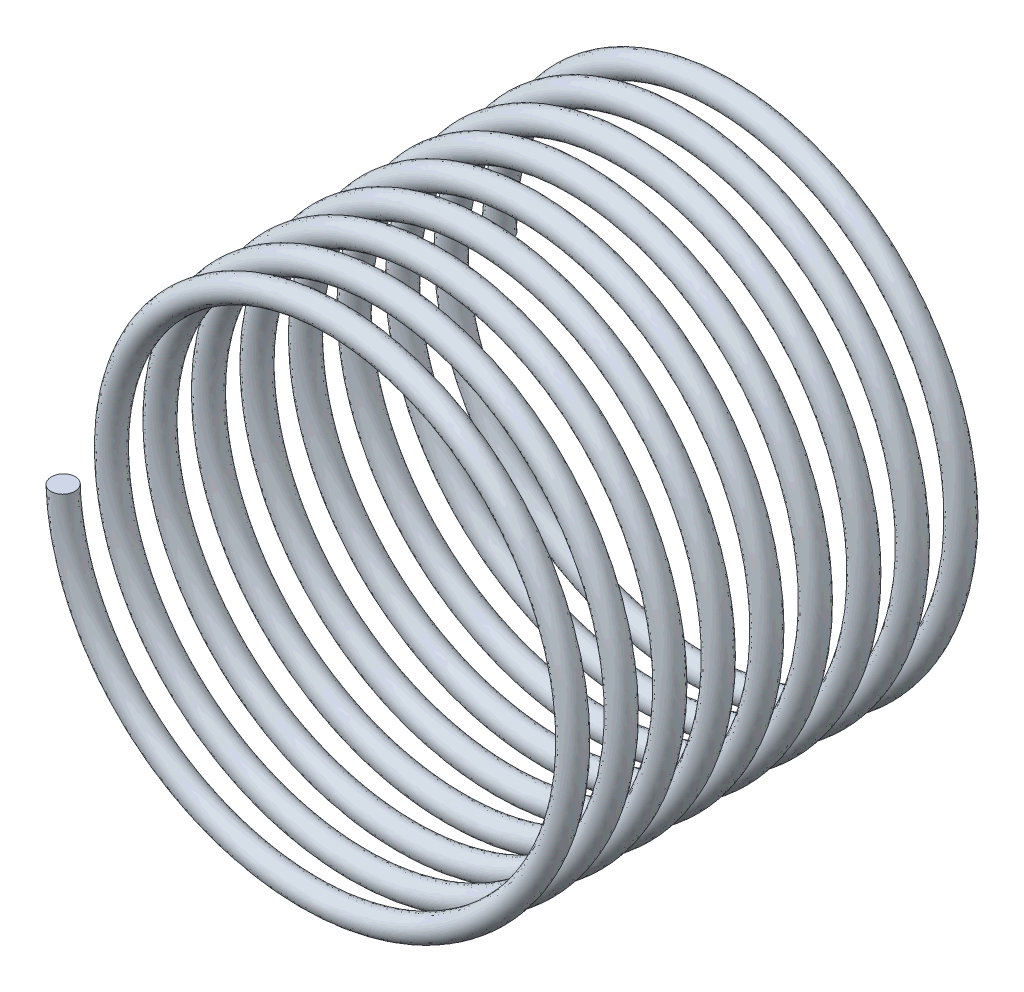
from build123d import *

# Parameters (mm, degrees)
SWEEP1_PITCH       = 10
SWEEP1_HEIGHT      = 90
SWEEP1_RADIUS      = 50
SWEEP1_START_ANGLE = -180
SWEEP1_PROFILE_R   = 2.5


with BuildPart() as part:
    # Sweep1: sweep along a helix
    with BuildLine() as sweep1_path:
        add(Helix(SWEEP1_PITCH, SWEEP1_HEIGHT, SWEEP1_RADIUS, center=(0, 0, 0), direction=(0, 0, 1), lefthand=True, mode=Mode.PRIVATE).rotate(Axis((0, 0, 0), (0, 0, 1)), SWEEP1_START_ANGLE))
    # Sweep1 profile (on start of the path) → Sweep1 (sweep)
    with BuildSketch(Plane(origin=(-50, 0, 0), x_dir=(0, -0.03181487509493671, 0.9994937787313605), z_dir=(1.5465538707133226e-13, 0.9994937787313605, 0.03181487509493671))):
        Circle(SWEEP1_PROFILE_R)
    sweep(path=sweep1_path.line, is_frenet=True)


solid = part.part
